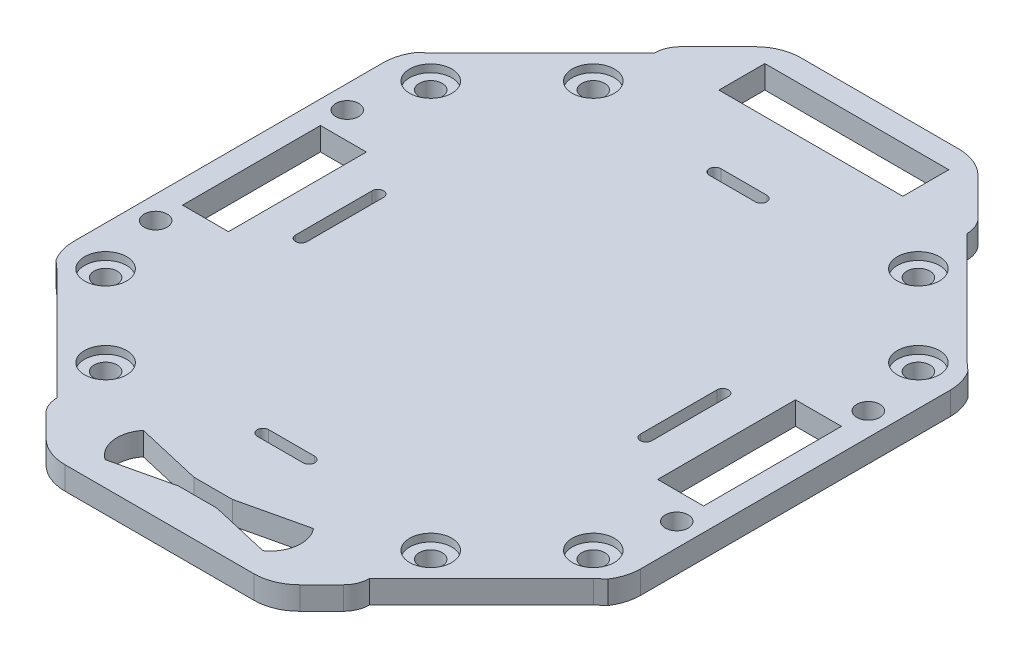
from build123d import *

# Parameters (mm, degrees)
SKETCH_1_R          = 1.5
EXTRUDE_1_DEPTH     = 3
SKETCH_2_R          = 2.75
CUT_EXTRUDE_1_DEPTH = 1
SKETCH_3_R          = 1.5
SKETCH_3_W          = 24
SKETCH_3_H          = 6
SKETCH_3_W_2        = 6
SKETCH_3_H_2        = 18
CUT_EXTRUDE_2_DEPTH = 10
CUT_EXTRUDE_3_DEPTH = 10
EXTRUDE_2_DEPTH     = 3
CUT_EXTRUDE_4_DEPTH = 3
CUT_EXTRUDE_5_DEPTH = 10


with BuildPart() as part:
    # 草图1 → 凸台-拉伸1 (new body)
    with BuildSketch(Plane(origin=(0, 0, 0), x_dir=(1, 0, 0), z_dir=(0, 1, 0))):
        with BuildLine():
            Line((-10.325901808, 48), (10.325901808, 48))
            ThreePointArc((10.325901808, 48), (12.622002402, 47.543277195), (14.568542495, 46.242640687))
            Line((14.568542495, 46.242640687), (30.405591591, 30.405591591))
            ThreePointArc((30.405591591, 30.405591591), (33.396603497, 27.086285733), (36.027027027, 23.474524992))
            ThreePointArc((36.027027027, 23.474524992), (36.751615519, 21.907494269), (37, 20.199009877))
            Line((37, 20.199009877), (37, -20.199009877))
            ThreePointArc((37, -20.199009877), (36.751615519, -21.907494269), (36.027027027, -23.474524992))
            ThreePointArc((36.027027027, -23.474524992), (33.396603497, -27.086285733), (30.405591591, -30.405591591))
            Line((30.405591591, -30.405591591), (14.568542495, -46.242640687))
            ThreePointArc((14.568542495, -46.242640687), (12.622002402, -47.543277195), (10.325901808, -48))
            Line((10.325901808, -48), (-10.325901808, -48))
            ThreePointArc((-10.325901808, -48), (-12.622002402, -47.543277195), (-14.568542495, -46.242640687))
            Line((-14.568542495, -46.242640687), (-30.405591591, -30.405591591))
            ThreePointArc((-30.405591591, -30.405591591), (-33.396603497, -27.086285733), (-36.027027027, -23.474524992))
            ThreePointArc((-36.027027027, -23.474524992), (-36.751615519, -21.907494269), (-37, -20.199009877))
            Line((-37, -20.199009877), (-37, 20.199009877))
            ThreePointArc((-37, 20.199009877), (-36.751615519, 21.907494269), (-36.027027027, 23.474524992))
            ThreePointArc((-36.027027027, 23.474524992), (-33.396603497, 27.086285733), (-30.405591591, 30.405591591))
            Line((-30.405591591, 30.405591591), (-14.568542495, 46.242640687))
            ThreePointArc((-14.568542495, 46.242640687), (-12.622002402, 47.543277195), (-10.325901808, 48))
        make_face()
        with Locations(Location((-21.213203436, 31.819805153, 0), (0, 0, 270))):
            Circle(SKETCH_1_R, mode=Mode.SUBTRACT)
        with Locations(Location((-31.819805153, 21.213203436, 0), (0, 0, 270))):
            Circle(SKETCH_1_R, mode=Mode.SUBTRACT)
        with Locations(Location((31.819805153, 21.213203436, 0), (0, 0, 90))):
            Circle(SKETCH_1_R, mode=Mode.SUBTRACT)
        with Locations(Location((21.213203436, 31.819805153, 0), (0, 0, 90))):
            Circle(SKETCH_1_R, mode=Mode.SUBTRACT)
        with Locations(Location((-31.819805153, -21.213203436, 0), (0, 0, 90))):
            Circle(SKETCH_1_R, mode=Mode.SUBTRACT)
        with Locations(Location((-21.213203436, -31.819805153, 0), (0, 0, 90))):
            Circle(SKETCH_1_R, mode=Mode.SUBTRACT)
        with Locations(Location((31.819805153, -21.213203436, 0), (0, 0, 270))):
            Circle(SKETCH_1_R, mode=Mode.SUBTRACT)
        with Locations(Location((21.213203436, -31.819805153, 0), (0, 0, 270))):
            Circle(SKETCH_1_R, mode=Mode.SUBTRACT)
    extrude(amount=EXTRUDE_1_DEPTH)

    # 草图2 → 切除-拉伸1 (cut)
    with BuildSketch(Plane(origin=(0, 3, 0), x_dir=(1, 0, 0), z_dir=(0, 1, 0))):
        with Locations(Location((-21.213203436, 31.819805153, 0), (0, 0, 270))):
            Circle(SKETCH_2_R)
        with Locations(Location((-31.819805153, 21.213203436, 0), (0, 0, 270))):
            Circle(SKETCH_2_R)
        with Locations(Location((21.213203436, 31.819805153, 0), (0, 0, 270))):
            Circle(SKETCH_2_R)
        with Locations(Location((31.819805153, 21.213203436, 0), (0, 0, 270))):
            Circle(SKETCH_2_R)
        with Locations(Location((-31.819805153, -21.213203436, 0), (0, 0, 270))):
            Circle(SKETCH_2_R)
        with Locations(Location((-21.213203436, -31.819805153, 0), (0, 0, 270))):
            Circle(SKETCH_2_R)
        with Locations(Location((21.213203436, -31.819805153, 0), (0, 0, 270))):
            Circle(SKETCH_2_R)
        with Locations(Location((31.819805153, -21.213203436, 0), (0, 0, 270))):
            Circle(SKETCH_2_R)
    extrude(amount=-CUT_EXTRUDE_1_DEPTH, mode=Mode.SUBTRACT)

    # 草图3 → 切除-拉伸2 (cut)
    with BuildSketch(Plane(origin=(0, 3, 0), x_dir=(1, 0, 0), z_dir=(0, 1, 0))):
        with Locations(Location((-34, 12.5, 0), (0, 0, 270))):
            Circle(SKETCH_3_R)
        with Locations(Location((-34, -12.5, 0), (0, 0, 270))):
            Circle(SKETCH_3_R)
        with Locations(Location((34, 12.5, 0), (0, 0, 270))):
            Circle(SKETCH_3_R)
        with Locations(Location((34, -12.5, 0), (0, 0, 270))):
            Circle(SKETCH_3_R)
        with Locations((0, -40)):
            Rectangle(SKETCH_3_W, SKETCH_3_H)
        with Locations((0, 42)):
            Rectangle(SKETCH_3_W, SKETCH_3_H)
        with Locations((31, 0)):
            Rectangle(SKETCH_3_W_2, SKETCH_3_H_2)
        with Locations((-31, 0)):
            Rectangle(SKETCH_3_W_2, SKETCH_3_H_2)
    extrude(amount=-CUT_EXTRUDE_2_DEPTH, mode=Mode.SUBTRACT)

    # 草图4 → 切除-拉伸3 (cut)
    with BuildSketch(Plane.XZ):
        with BuildLine():
            Line((-12.325901808, 46), (12.325901808, 46))
            ThreePointArc((12.325901808, 46), (14.622002402, 45.543277195), (16.568542495, 44.242640687))
            Line((16.568542495, 44.242640687), (16.568542495, 49))
            Line((16.568542495, 49), (-16.568542495, 49))
            Line((-16.568542495, 49), (-16.568542495, 44.242640687))
            ThreePointArc((-16.568542495, 44.242640687), (-14.622002402, 45.543277195), (-12.325901808, 46))
        make_face()
    extrude(amount=-CUT_EXTRUDE_3_DEPTH, mode=Mode.SUBTRACT)

    # 草图5 → 凸台-拉伸2 (add)
    with BuildSketch(Plane.XZ):
        Polygon((-12, 37), (-12, 36), (12, 36), (12, 37), (13, 37), (13, 43), (12, 43), (12, 44), (-12, 44), (-12, 43), (-13, 43), (-13, 37), align=None)
        with BuildLine():
            Line((-10.3, 42.808101317), (-2.5, 41))
            Line((-2.5, 41), (2.5, 41))
            Line((2.5, 41), (10.3, 42.808101317))
            ThreePointArc((10.3, 42.808101317), (11.962490365, 40.08199487), (11.1, 37.007642751))
            Line((11.1, 37.007642751), (2.5, 39))
            Line((2.5, 39), (-2.5, 39))
            Line((-2.5, 39), (-11.1, 37.007642751))
            ThreePointArc((-11.1, 37.007642751), (-11.962490365, 40.08199487), (-10.3, 42.808101317))
        make_face(mode=Mode.SUBTRACT)
    extrude(amount=-EXTRUDE_2_DEPTH)

    # 草图6 → 切除-拉伸4 (cut)
    with BuildSketch(Plane.XZ):
        with BuildLine():
            Line((-21.75, 5), (-21.75, -5))
            ThreePointArc((-21.75, -5), (-22.5, -5.75), (-23.25, -5))
            Line((-23.25, -5), (-23.25, 5))
            ThreePointArc((-23.25, 5), (-22.5, 5.75), (-21.75, 5))
        make_face()
        with BuildLine():
            Line((-3, 30.25), (3, 30.25))
            ThreePointArc((3, 30.25), (3.75, 29.5), (3, 28.75))
            Line((3, 28.75), (-3, 28.75))
            ThreePointArc((-3, 28.75), (-3.75, 29.5), (-3, 30.25))
        make_face()
        with BuildLine():
            Line((-3, -30.25), (3, -30.25))
            ThreePointArc((3, -30.25), (3.75, -29.5), (3, -28.75))
            Line((3, -28.75), (-3, -28.75))
            ThreePointArc((-3, -28.75), (-3.75, -29.5), (-3, -30.25))
        make_face()
        with BuildLine():
            Line((21.75, 5), (21.75, -5))
            ThreePointArc((21.75, -5), (22.5, -5.75), (23.25, -5))
            Line((23.25, -5), (23.25, 5))
            ThreePointArc((23.25, 5), (22.5, 5.75), (21.75, 5))
        make_face()
    extrude(amount=-CUT_EXTRUDE_4_DEPTH, mode=Mode.SUBTRACT)

    # 草图7 → 切除-拉伸5 (cut)
    with BuildSketch(Plane.XZ):
        with BuildLine():
            Line((-20.39696962, 39), (-35.001785669, 24.395183951))
            Line((-35.001785669, 24.395183951), (-36.027027027, 23.474524992))
            Line((-36.027027027, 23.474524992), (-38.280094512, 25.727592477))
            Line((-38.280094512, 25.727592477), (-20.995221523, 43.012465466))
            Line((-20.995221523, 43.012465466), (-19.39696962, 41.414213562))
            ThreePointArc((-19.39696962, 41.414213562), (-20.137078087, 40.306562965), (-20.39696962, 39))
        make_face()
        with BuildLine():
            Line((38.280094512, 25.727592477), (36.027027027, 23.474524992))
            Line((36.027027027, 23.474524992), (35.001785669, 24.395183951))
            Line((35.001785669, 24.395183951), (20.39696962, 39))
            ThreePointArc((20.39696962, 39), (20.137078087, 40.306562965), (19.39696962, 41.414213562))
            Line((19.39696962, 41.414213562), (20.995221523, 43.012465466))
            Line((20.995221523, 43.012465466), (38.280094512, 25.727592477))
        make_face()
        with BuildLine():
            Line((35.001785669, -24.395183951), (36.027027027, -23.474524992))
            Line((36.027027027, -23.474524992), (38.280094512, -25.727592477))
            Line((38.280094512, -25.727592477), (20.995221523, -43.012465466))
            Line((20.995221523, -43.012465466), (19.39696962, -41.414213562))
            ThreePointArc((19.39696962, -41.414213562), (20.137078087, -40.306562965), (20.39696962, -39))
            Line((20.39696962, -39), (35.001785669, -24.395183951))
        make_face()
        with BuildLine():
            Line((-20.995221523, -43.012465466), (-38.280094512, -25.727592477))
            Line((-38.280094512, -25.727592477), (-36.027027027, -23.474524992))
            Line((-36.027027027, -23.474524992), (-35.001785669, -24.395183951))
            Line((-35.001785669, -24.395183951), (-20.39696962, -39))
            ThreePointArc((-20.39696962, -39), (-20.137078087, -40.306562965), (-19.39696962, -41.414213562))
            Line((-19.39696962, -41.414213562), (-20.995221523, -43.012465466))
        make_face()
    extrude(amount=-CUT_EXTRUDE_5_DEPTH, mode=Mode.SUBTRACT)


solid = part.part
